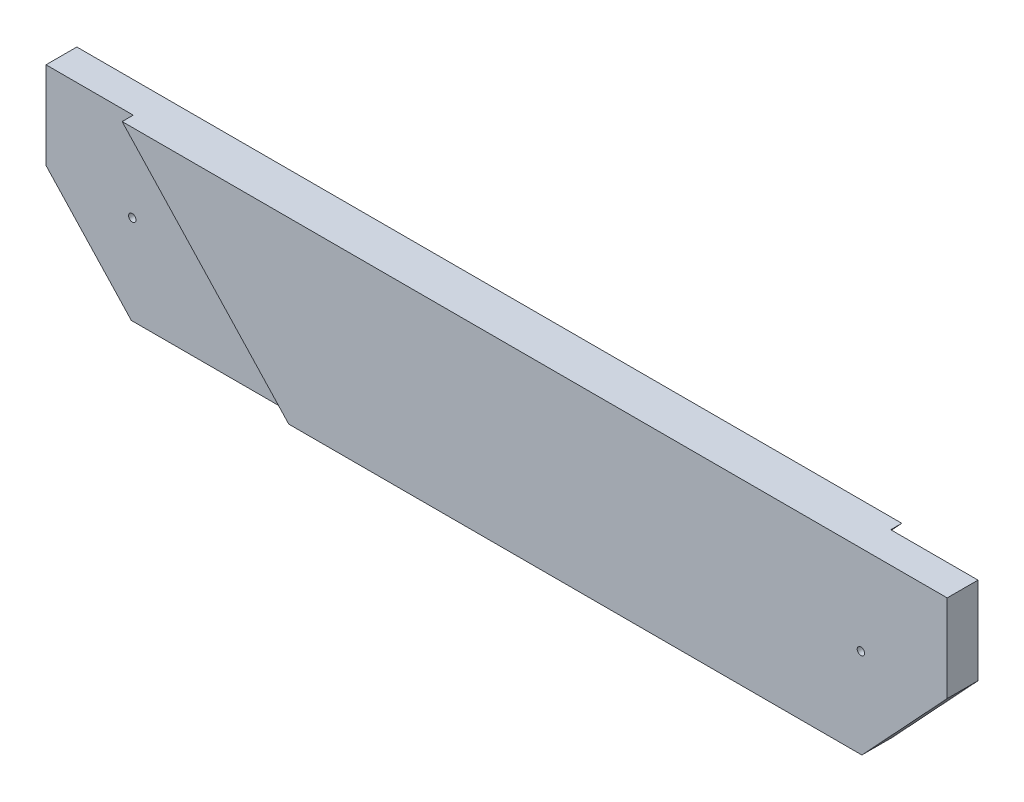
from build123d import *

# Parameters (mm, degrees)
SKETCH1_W           = 740
SKETCH1_H           = 145
BOSS_EXTRUDE1_DEPTH = 34
SKETCH2_R           = 3
CUT_EXTRUDE1_DEPTH  = 379.566044436
CUT_EXTRUDE2_DEPTH  = 379.566044436
CUT_EXTRUDE3_DEPTH  = 9
CUT_EXTRUDE4_DEPTH  = 9


with BuildPart() as part:
    # Sketch1 → Boss-Extrude1 (new body)
    with BuildSketch(Plane.XY):
        Rectangle(SKETCH1_W, SKETCH1_H)
    extrude(amount=BOSS_EXTRUDE1_DEPTH)

    # Sketch2 → Cut-Extrude1 (cut, through all)
    with BuildSketch(Plane.XY.offset(34)):
        with Locations((-300, 0)):
            Circle(SKETCH2_R)
    cut_extrude1 = extrude(amount=-CUT_EXTRUDE1_DEPTH, mode=Mode.SUBTRACT)

    # Mirror1: Cut-Extrude1 across plane
    add(cut_extrude1.mirror(Plane(origin=(0, 0, 0), x_dir=(0, 0, 1), z_dir=(1, 0, 0))), mode=Mode.SUBTRACT)

    # Sketch3 → Cut-Extrude2 (cut, through all)
    with BuildSketch(Plane(origin=(0, 0, 0), x_dir=(-1, 0, 0), z_dir=(0, 0, -1))):
        Polygon((-370, 1.769559051), (-300.776712208, -72.5), (-300.776712208, -90.031965517), (-434.728473362, -90.031965517), (-434.728473362, 1.769559051), align=None)
        Polygon((300.776712208, -72.5), (370, 1.769559051), (452.615528046, -36.803788203), (398.593275425, -163.670382496), align=None)
    extrude(amount=-CUT_EXTRUDE2_DEPTH, mode=Mode.SUBTRACT)

    # Sketch4 → Cut-Extrude3 (cut)
    with BuildSketch(Plane.XY.offset(34)):
        Polygon((-485.714618039, 114.044241674), (-337.944791384, 114.044241674), (-115.198220107, -124.940212205), (-485.714618039, -111.910111467), align=None)
    extrude(amount=-CUT_EXTRUDE3_DEPTH, mode=Mode.SUBTRACT)

    # Sketch5 → Cut-Extrude4 (cut)
    with BuildSketch(Plane(origin=(0, 0, 0), x_dir=(-1, 0, 0), z_dir=(0, 0, -1))):
        Polygon((-568.705938923, 127.353116935), (-361.833214072, 139.674093651), (-111.696100657, -128.697630779), (-536.326991512, -147.10621474), align=None)
    extrude(amount=-CUT_EXTRUDE4_DEPTH, mode=Mode.SUBTRACT)


solid = part.part
